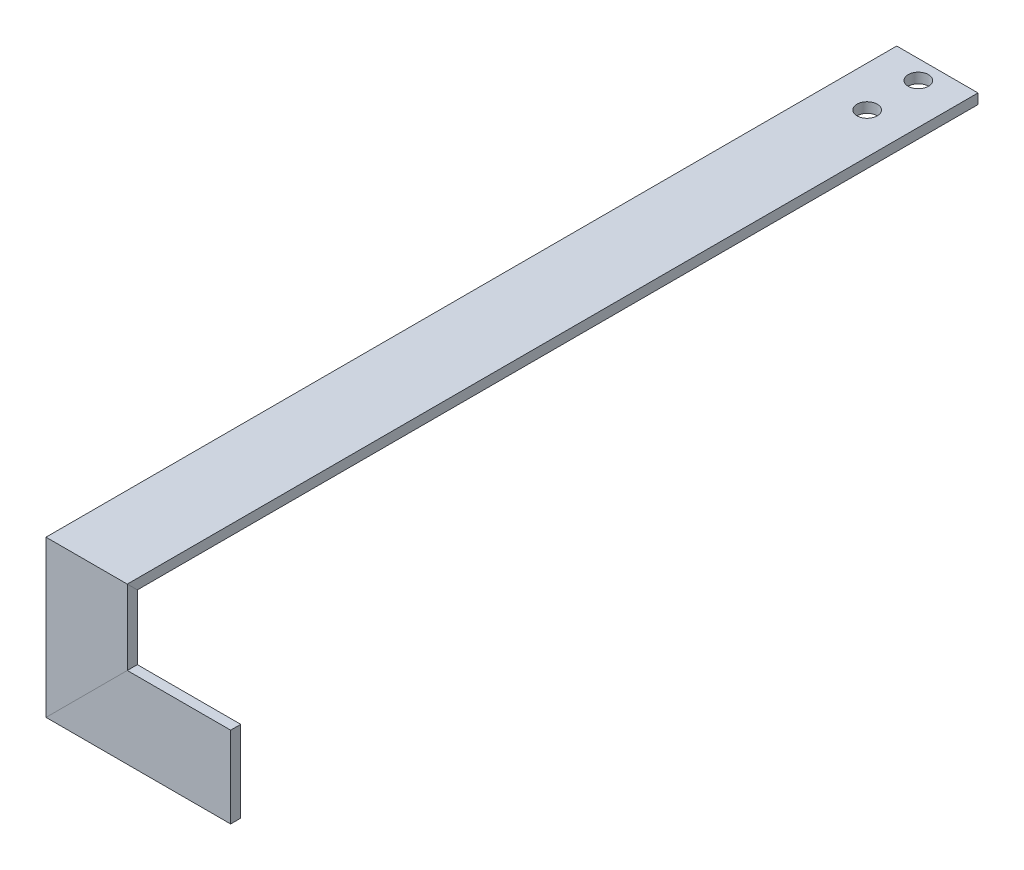
from build123d import *

# Parameters (mm, degrees)
CROQUIS1_W            = 50.8
CROQUIS1_H            = 6.31
CROQUIS2_R            = 6.35
CORTAR_EXTRUIR1_DEPTH = 6.31


with BuildPart() as part:
    # Barrer1: sweep along a curve in space
    with BuildLine() as barrer1_path:
        Line((0, 0, 0), (0, 0, 528.55))
        Line((0, 0, 528.55), (0, -69, 528.55))
        Line((0, -69, 528.55), (90, -69, 528.55))
    # Croquis1 → Barrer1 (sweep)
    with BuildSketch(Plane.XY):
        Rectangle(CROQUIS1_W, CROQUIS1_H)
    sweep(path=barrer1_path.line, transition=Transition.RIGHT)

    # Croquis2 → Cortar-Extruir1 (cut)
    with BuildSketch(Plane(origin=(0, 3.155, 0), x_dir=(1, 0, 0), z_dir=(0, 1, 0))):
        with Locations(Location((0, -43.892204666, 0), (0, 0, 270))):
            Circle(CROQUIS2_R)
        with Locations(Location((0, -11.892204666, 0), (0, 0, 270))):
            Circle(CROQUIS2_R)
    extrude(amount=-CORTAR_EXTRUIR1_DEPTH, mode=Mode.SUBTRACT)


solid = part.part
